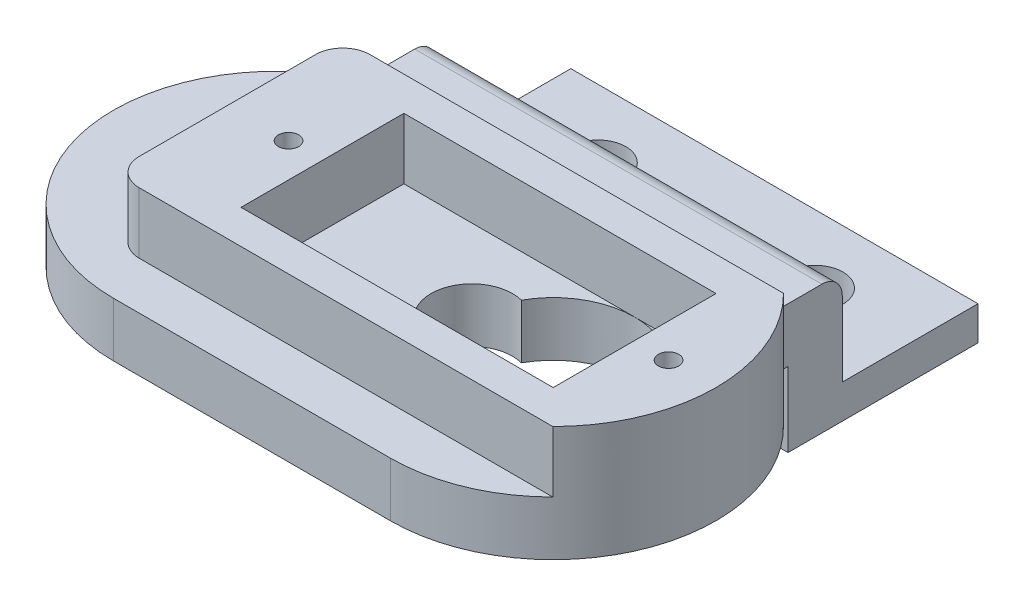
from build123d import *

# Parameters (mm, degrees)
BOSS_EXTRU_1_DEPTH      = 4
ESQUISSE2_R             = 3.75
BOSS_EXTRU_2_DEPTH      = 5.5
ESQUISSE3_R             = 2.5
BOSS_EXTRU_3_DEPTH      = 2
ENL_V_MAT_EXTRU_2_DEPTH = 30.955633861
BOSS_EXTRU_7_DEPTH      = 4.5
ESQUISSE7_R             = 0.75
ENL_V_MAT_EXTRU_3_DEPTH = 8
ESQUISSE8_W             = 30
ESQUISSE8_H             = 4
BOSS_EXTRU_8_DEPTH      = 5.5
ESQUISSE9_W             = 30
ESQUISSE9_H             = 2.5
BOSS_EXTRU_9_DEPTH      = 10
ESQUISSE10_R            = 2.05
ENL_V_MAT_EXTRU_4_DEPTH = 37.43267764
CONG_2_R                = 1.5


with BuildPart() as part:
    # Esquisse1 → Boss.-Extru.1 (new body)
    with BuildSketch(Plane(origin=(0, 0, 0), x_dir=(1, 0, 0), z_dir=(0, 1, 0))):
        with BuildLine():
            Line((-15, 10.998181668), (-15, 16.5))
            Line((-15, 16.5), (15, 16.5))
            Line((15, 16.5), (15, 10.998181668))
            ThreePointArc((15, 10.998181668), (21.946875755, -2.451715724), (10.2, -12))
            Line((10.2, -12), (-10.2, -12))
            ThreePointArc((-10.2, -12), (-21.946875755, -2.451715724), (-15, 10.998181668))
        make_face()
    extrude(amount=BOSS_EXTRU_1_DEPTH)

    # Esquisse2 → Boss.-Extru.2 (add)
    with BuildSketch(Plane.XZ):
        with Locations(Location((-10.2, 0, 0), (0, 0, 90))):
            Circle(ESQUISSE2_R)
    extrude(amount=BOSS_EXTRU_2_DEPTH)

    # Esquisse3 → Boss.-Extru.3 (add)
    with BuildSketch(Plane.XZ.offset(5.5)):
        with Locations(Location((-10.2, 0, 0), (0, 0, 270))):
            Circle(ESQUISSE3_R)
    extrude(amount=BOSS_EXTRU_3_DEPTH)

    # Esquisse5 → Enlèv. mat.-Extru.2 (cut, through all)
    with BuildSketch(Plane(origin=(0, 4, 0), x_dir=(1, 0, 0), z_dir=(0, 1, 0))):
        with BuildLine():
            ThreePointArc((4.95, 2.90473751), (16.2, 0), (4.95, -2.90473751))
            ThreePointArc((4.95, -2.90473751), (1.2, 0), (4.95, 2.90473751))
        make_face()
    extrude(amount=-ENL_V_MAT_EXTRU_2_DEPTH, mode=Mode.SUBTRACT)

    # Esquisse6 → Boss.-Extru.7 (add)
    with BuildSketch(Plane(origin=(0, 4, 0), x_dir=(1, 0, 0), z_dir=(0, 1, 0))):
        with BuildLine():
            ThreePointArc((18.670537173, -8.5), (22.2, 0), (18.670537173, 8.5))
            Line((18.670537173, 8.5), (-11.8, 8.5))
            ThreePointArc((-11.8, 8.5), (-13.214213562, 7.914213562), (-13.8, 6.5))
            Line((-13.8, 6.5), (-13.8, -6.5))
            ThreePointArc((-13.8, -6.5), (-13.214213562, -7.914213562), (-11.8, -8.5))
            Line((-11.8, -8.5), (18.670537173, -8.5))
        make_face()
        Polygon((16.2, 0), (16.2, -6), (10.2, -6), (-6.8, -6), (-6.8, 6), (10.2, 6), (16.2, 6), align=None, mode=Mode.SUBTRACT)
    extrude(amount=BOSS_EXTRU_7_DEPTH)

    # Esquisse7 → Enlèv. mat.-Extru.3 (cut)
    with BuildSketch(Plane(origin=(0, 8.5, 0), x_dir=(1, 0, 0), z_dir=(0, 1, 0))):
        with BuildLine():
            ThreePointArc((-10.05, 0), (-9.3, -0.75), (-8.55, 0))
            Line((-8.55, 0), (-10.05, 0))
        make_face()
        with BuildLine():
            Line((-10.05, 0), (-8.55, 0))
            ThreePointArc((-8.55, 0), (-9.3, 0.75), (-10.05, 0))
        make_face()
        with Locations(Location((18.7, 0, 0), (0, 0, 270))):
            Circle(ESQUISSE7_R)
    extrude(amount=-ENL_V_MAT_EXTRU_3_DEPTH, mode=Mode.SUBTRACT)

    # Esquisse8 → Boss.-Extru.8 (add)
    with BuildSketch(Plane.XZ):
        with Locations((0, -14.5)):
            Rectangle(ESQUISSE8_W, ESQUISSE8_H)
    extrude(amount=BOSS_EXTRU_8_DEPTH)

    # Esquisse9 → Boss.-Extru.9 (add)
    with BuildSketch(Plane(origin=(0, 0, -16.5), x_dir=(-1, 0, 0), z_dir=(0, 0, -1))):
        with Locations((0, -4.25)):
            Rectangle(ESQUISSE9_W, ESQUISSE9_H)
    extrude(amount=BOSS_EXTRU_9_DEPTH)

    # Esquisse10 → Enlèv. mat.-Extru.4 (cut, through all)
    with BuildSketch(Plane(origin=(0, -3, 0), x_dir=(1, 0, 0), z_dir=(0, 1, 0))):
        with Locations(Location((-8, 21.5, 0), (0, 0, 270))):
            Circle(ESQUISSE10_R)
        with Locations(Location((8, 21.5, 0), (0, 0, 90))):
            Circle(ESQUISSE10_R)
    extrude(amount=-ENL_V_MAT_EXTRU_4_DEPTH, mode=Mode.SUBTRACT)

    # Congé2
    cong_2_edges = [part.edges().sort_by_distance(p)[0] for p in [
        (0, 4, -16.5),
    ]]
    fillet(cong_2_edges, radius=CONG_2_R)


solid = part.part
